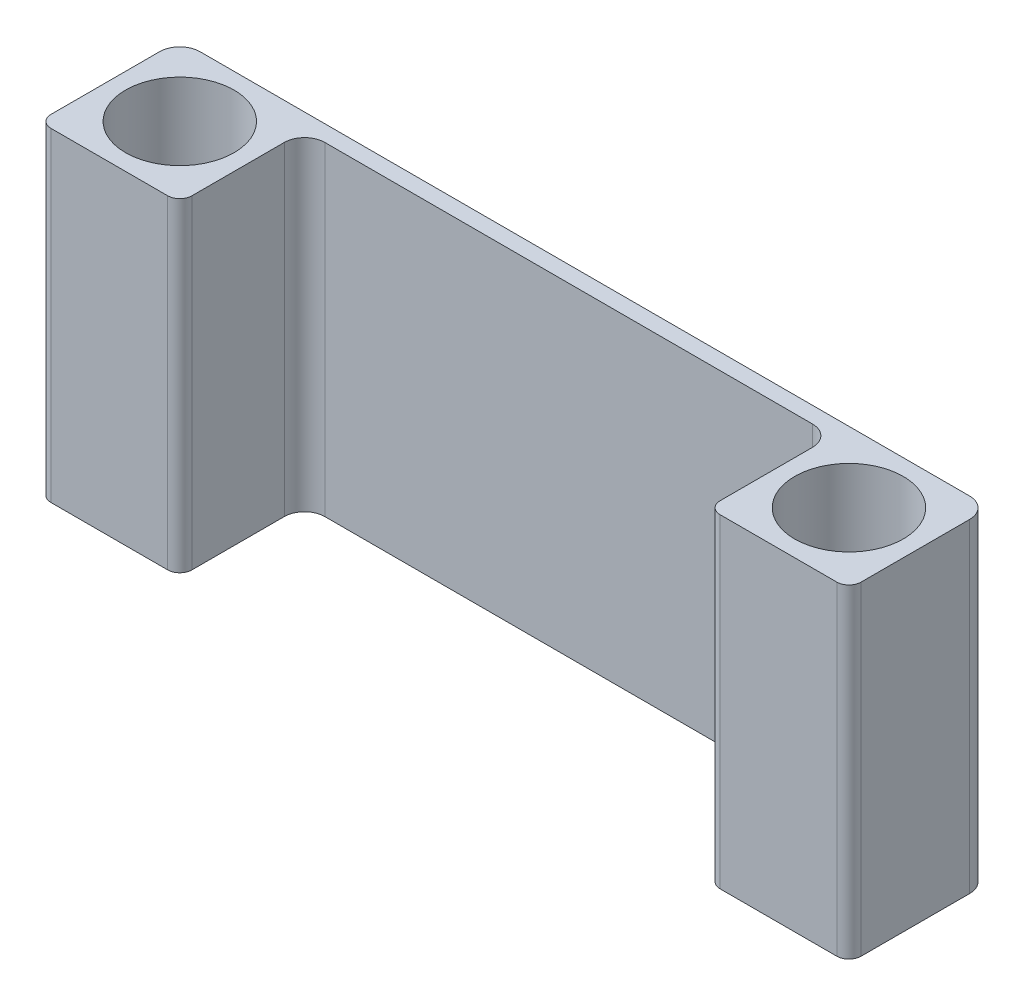
from build123d import *

# Parameters (mm, degrees)
SKETCH1_R           = 13.4
BOSS_EXTRUDE1_DEPTH = 80
FILLET1_R           = 5
FILLET2_R           = 3


with BuildPart() as part:
    # Sketch1 → Boss-Extrude1 (new body)
    with BuildSketch(Plane(origin=(0, 0, 0), x_dir=(1, 0, 0), z_dir=(0, 1, 0))):
        Polygon((-17.4, 17.4), (17.4, 17.4), (82.6, 17.4), (82.6, 13.4), (17.4, 13.4), (17.4, -17.4), (-17.4, -17.4), align=None)
        with Locations(Location((0, 0, 0), (0, 0, 270))):
            Circle(SKETCH1_R, mode=Mode.SUBTRACT)
    boss_extrude1 = extrude(amount=BOSS_EXTRUDE1_DEPTH)

    # Mirror3: Boss-Extrude1 across plane
    add(boss_extrude1.mirror(Plane(origin=(82.6, 80, 0), x_dir=(0, 0, 1), z_dir=(1, 0, 0))))

    # Fillet1
    fillet1_edges = [part.edges().sort_by_distance(p)[0] for p in [
        (17.4, 40, -13.4),
        (-17.4, 40, -17.4),
        (147.8, 40, -13.4),
        (182.6, 40, -17.4),
    ]]
    fillet(fillet1_edges, radius=FILLET1_R)

    # Fillet2
    fillet2_edges = [part.edges().sort_by_distance(p)[0] for p in [
        (17.4, 40, 17.4),
        (-17.4, 40, 17.4),
        (147.8, 40, 17.4),
        (182.6, 40, 17.4),
    ]]
    fillet(fillet2_edges, radius=FILLET2_R)


solid = part.part
